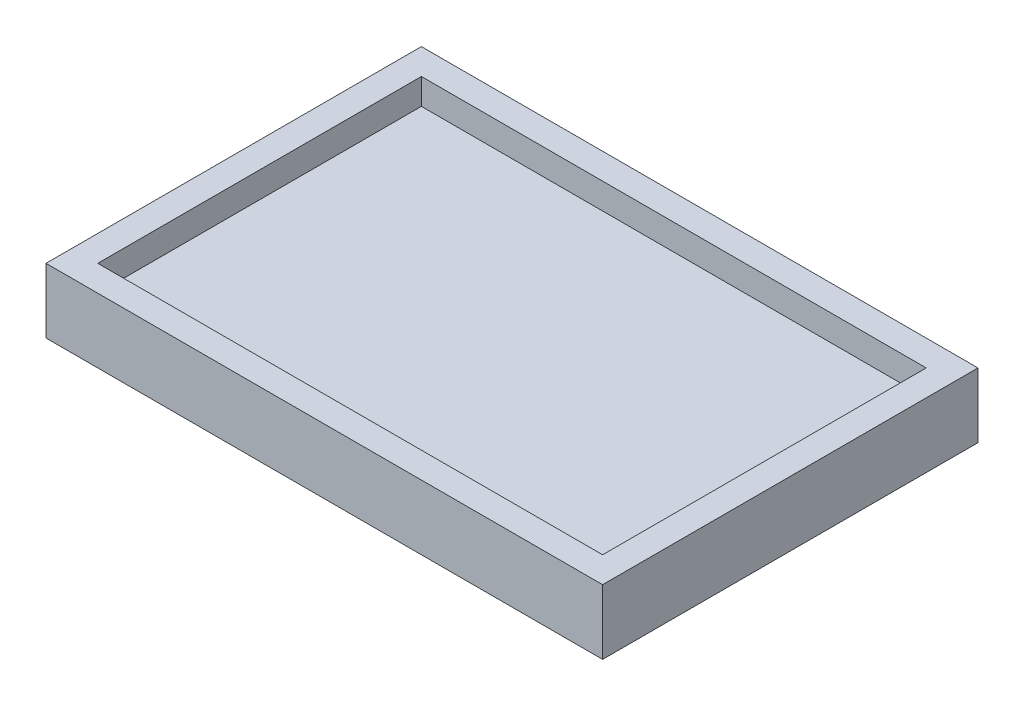
from build123d import *

# Parameters (mm, degrees)
ESQUISSE1_W             = 43
ESQUISSE1_H             = 29
BOSS_EXTRU_1_DEPTH      = 5
ESQUISSE3_W             = 39
ESQUISSE3_H             = 25
ENL_V_MAT_EXTRU_2_DEPTH = 2


with BuildPart() as part:
    # Esquisse1 → Boss.-Extru.1 (new body)
    with BuildSketch(Plane(origin=(0, 0, 0), x_dir=(1, 0, 0), z_dir=(0, 1, 0))):
        Rectangle(ESQUISSE1_W, ESQUISSE1_H)
    extrude(amount=BOSS_EXTRU_1_DEPTH)

    # Esquisse3 → Enlèv. mat.-Extru.2 (cut)
    with BuildSketch(Plane(origin=(0, 5, 0), x_dir=(1, 0, 0), z_dir=(0, 1, 0))):
        Rectangle(ESQUISSE3_W, ESQUISSE3_H)
    extrude(amount=-ENL_V_MAT_EXTRU_2_DEPTH, mode=Mode.SUBTRACT)


solid = part.part
